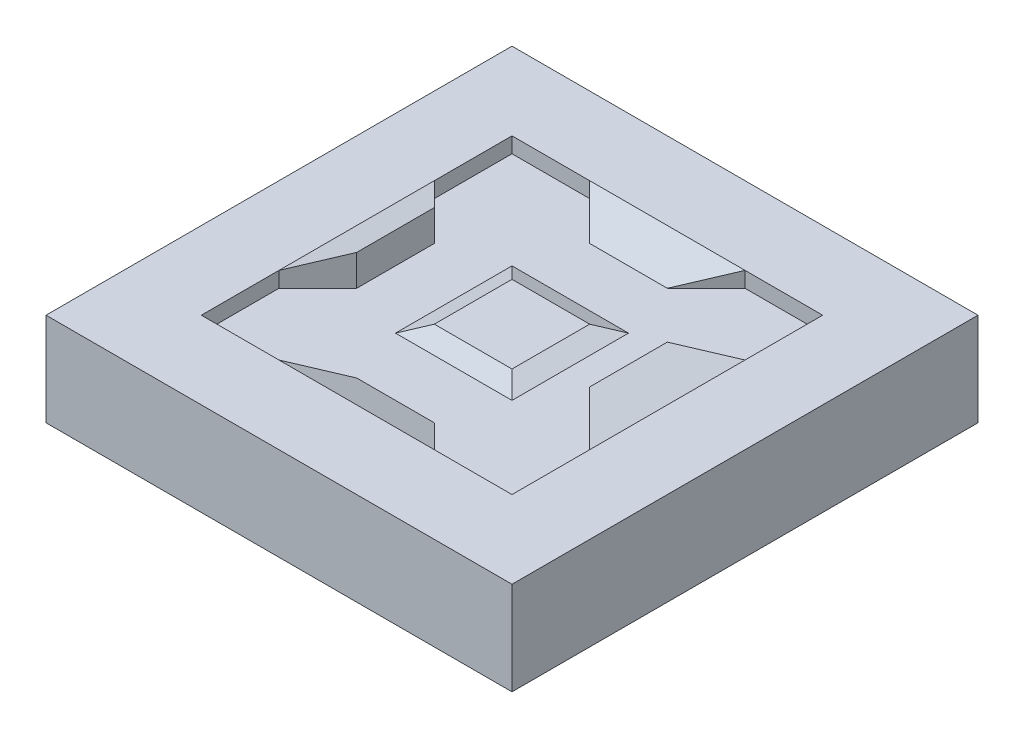
from build123d import *

# Parameters (mm, degrees)
EXTRUDE1_DEPTH       = 101.6
EXTRUDE1_DEPTH_BACK  = 508
SKETCH1_W            = 3048
SKETCH1_H            = 3048
SKETCH2_W            = 2032
SKETCH2_H            = 2032
EXTRUDE2_DEPTH       = 101.6
SKETCH3_W            = 762
SKETCH3_H            = 762
EXTRUDE3_DEPTH       = 50.8
EXTRUDE3_TAPER       = 68.1986
EXTRUDE6_DEPTH       = 101.6
EXTRUDE7_DEPTH       = 508
EXTRUDE7_DEPTH_BACK  = 508
EXTRUDE8_DEPTH       = 203.2
EXTRUDE12_DEPTH      = 508
EXTRUDE12_DEPTH_BACK = 508


with BuildPart() as part:
    # Sketch1 → Extrude1 (new, two sides: drawn at the far end of the back side and taken through both)
    with BuildSketch(Plane(origin=(0, 0, 0), x_dir=(1, 0, 0), z_dir=(0, 1, 0)).offset(-EXTRUDE1_DEPTH_BACK)):
        Rectangle(SKETCH1_W, SKETCH1_H)
    extrude(amount=EXTRUDE1_DEPTH + EXTRUDE1_DEPTH_BACK)

    # Sketch2 → Extrude2 (cut)
    with BuildSketch(Plane(origin=(0, 101.6, 0), x_dir=(1, 0, 0), z_dir=(0, 1, 0))):
        Rectangle(SKETCH2_W, SKETCH2_H)
    extrude(amount=-EXTRUDE2_DEPTH, mode=Mode.SUBTRACT)

    # Sketch3 → Extrude3 (add)
    with BuildSketch(Plane(origin=(0, 0, 0), x_dir=(1, 0, 0), z_dir=(0, 1, 0))):
        Rectangle(SKETCH3_W, SKETCH3_H)
    extrude(amount=EXTRUDE3_DEPTH, taper=EXTRUDE3_TAPER)

    # Sketch4 → Extrude6 (add)
    with BuildSketch(Plane(origin=(0, 0, 0), x_dir=(1, 0, 0), z_dir=(0, 1, 0))):
        Polygon((-253.999939021, 762), (-507.999939021, 1016), (507.999939021, 1016), (253.999939021, 762), align=None)
        Polygon((-253.999939021, -762), (253.999939021, -762), (507.999939021, -1016), (-507.999939021, -1016), align=None)
    extrude(amount=EXTRUDE6_DEPTH)

    # Sketch6 → Extrude7 (cut, two sides: drawn at the far end of the back side and taken through both)
    with BuildSketch(Plane(origin=(0, 0, 0), x_dir=(0, 0, -1), z_dir=(1, 0, 0)).offset(-EXTRUDE7_DEPTH_BACK)):
        Polygon((762, 101.6), (762, 0), (1016, 101.6), align=None)
        Polygon((-1016, 101.6), (-762, 0), (-762, 101.6), align=None)
    extrude(amount=EXTRUDE7_DEPTH + EXTRUDE7_DEPTH_BACK, mode=Mode.SUBTRACT)

    # Sketch8 → Extrude8 (add)
    with BuildSketch(Plane(origin=(0, 0, 0), x_dir=(1, 0, 0), z_dir=(0, 1, 0))):
        Polygon((762, 253.999939021), (1016, 507.999939021), (1016, -507.999939021), (762, -253.999939021), align=None)
        Polygon((-762, 253.999939021), (-762, -253.999939021), (-1016, -507.999939021), (-1016, 507.999939021), align=None)
    extrude(amount=EXTRUDE8_DEPTH)

    # Sketch10 → Extrude12 (cut, two sides: drawn at the far end of the back side and taken through both)
    with BuildSketch(Plane.XY.offset(-EXTRUDE12_DEPTH_BACK)):
        Polygon((-1016, 203.2), (-1016, 101.6), (-762, 203.2), align=None)
        Polygon((1016, 203.2), (1016, 101.6), (762, 203.2), align=None)
    extrude(amount=EXTRUDE12_DEPTH + EXTRUDE12_DEPTH_BACK, mode=Mode.SUBTRACT)


solid = part.part
